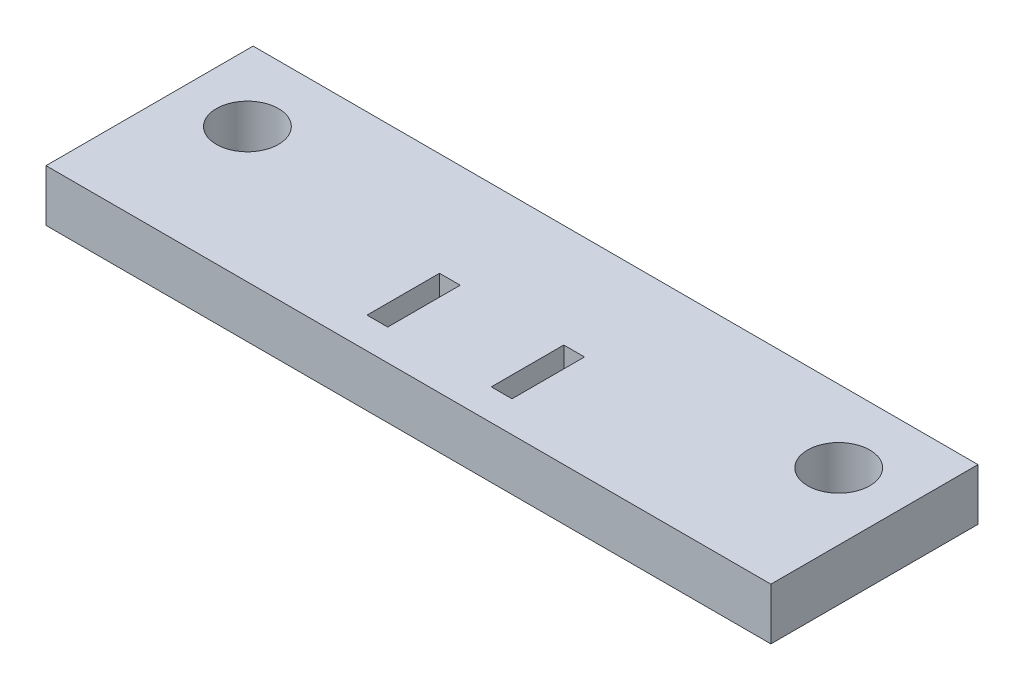
from build123d import *

# Parameters (mm, degrees)
SKETCH_1_W      = 70
SKETCH_1_H      = 20
SKETCH_1_R      = 3
SKETCH_1_W_2    = 2
SKETCH_1_H_2    = 7
EXTRUDE_1_DEPTH = 5


with BuildPart() as part:
    # 草图1 → 凸台-拉伸1 (new body)
    with BuildSketch(Plane(origin=(0, 0, 0), x_dir=(1, 0, 0), z_dir=(0, 1, 0))):
        Rectangle(SKETCH_1_W, SKETCH_1_H)
        with Locations(Location((-28.55, 3, 0), (0, 0, 270))):
            Circle(SKETCH_1_R, mode=Mode.SUBTRACT)
        with Locations(Location((28.55, 3, 0), (0, 0, 270))):
            Circle(SKETCH_1_R, mode=Mode.SUBTRACT)
        with Locations((-6, -3.5)):
            Rectangle(SKETCH_1_W_2, SKETCH_1_H_2, mode=Mode.SUBTRACT)
        with Locations((6, -3.5)):
            Rectangle(SKETCH_1_W_2, SKETCH_1_H_2, mode=Mode.SUBTRACT)
    extrude(amount=EXTRUDE_1_DEPTH)


solid = part.part
